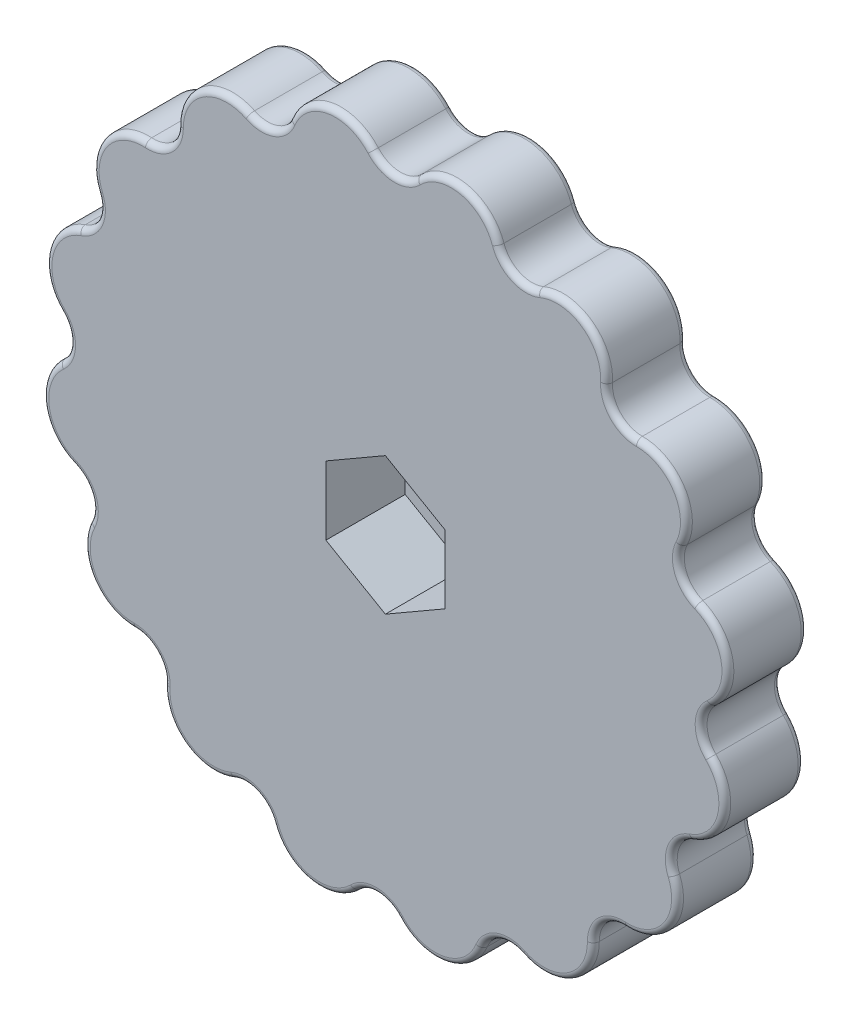
from build123d import *

# Parameters (mm, degrees)
BOSS_EXTRUDE1_DEPTH = 4
SKETCH2_R           = 6
BOSS_EXTRUDE2_DEPTH = 1.999999862
CUT_EXTRUDE1_REACH  = 27.171
SKETCH3_R           = 1.8
CUT_EXTRUDE2_DEPTH  = 4
FILLET1_R           = 0.5
FILLET2_R           = 0.3


with BuildPart() as part:
    # Sketch1 → Boss-Extrude1 (new body)
    with BuildSketch(Plane(origin=(0, 0, 1.999999862), x_dir=(-1, 0, 0), z_dir=(0, 0, -1))):
        with BuildLine():
            ThreePointArc((-1.539082875, 16.380637516), (-0.42924165, 15.932983314), (0.654887214, 16.439744045))
            ThreePointArc((0.654887214, 16.439744045), (2.950611225, 17.24946067), (4.846671421, 15.722717248))
            ThreePointArc((4.846671421, 15.722717248), (5.700721168, 14.884420844), (6.896254571, 14.937728556))
            ThreePointArc((6.896254571, 14.937728556), (9.327092134, 14.807273629), (10.49456393, 12.671155805))
            ThreePointArc((10.49456393, 12.671155805), (10.962800865, 11.569840227), (12.087729685, 11.161579305))
            ThreePointArc((12.087729685, 11.161579305), (14.283607817, 10.110813406), (14.544754213, 7.690525756))
            ThreePointArc((14.544754213, 7.690525756), (14.555893508, 6.493856317), (15.438957529, 5.686180785))
            ThreePointArc((15.438957529, 5.686180785), (17.065573691, 3.875073497), (16.380637516, 1.539082875))
            ThreePointArc((16.380637516, 1.539082875), (15.932983314, 0.42924165), (16.439744045, -0.654887214))
            ThreePointArc((16.439744045, -0.654887214), (17.24946067, -2.950611225), (15.722717248, -4.846671421))
            ThreePointArc((15.722717248, -4.846671421), (14.884420844, -5.700721168), (14.937728556, -6.896254571))
            ThreePointArc((14.937728556, -6.896254571), (14.807273629, -9.327092134), (12.671155805, -10.49456393))
            ThreePointArc((12.671155805, -10.49456393), (11.569840227, -10.962800865), (11.161579305, -12.087729685))
            ThreePointArc((11.161579305, -12.087729685), (10.110813406, -14.283607817), (7.690525756, -14.544754213))
            ThreePointArc((7.690525756, -14.544754213), (6.493856317, -14.555893508), (5.686180785, -15.438957529))
            ThreePointArc((5.686180785, -15.438957529), (3.875073497, -17.065573691), (1.539082875, -16.380637516))
            ThreePointArc((1.539082875, -16.380637516), (0.42924165, -15.932983314), (-0.654887214, -16.439744045))
            ThreePointArc((-0.654887214, -16.439744045), (-2.950611225, -17.24946067), (-4.846671421, -15.722717248))
            ThreePointArc((-4.846671421, -15.722717248), (-5.700721168, -14.884420844), (-6.896254571, -14.937728556))
            ThreePointArc((-6.896254571, -14.937728556), (-9.327092134, -14.807273629), (-10.49456393, -12.671155805))
            ThreePointArc((-10.49456393, -12.671155805), (-10.962800865, -11.569840227), (-12.087729685, -11.161579305))
            ThreePointArc((-12.087729685, -11.161579305), (-14.283607817, -10.110813406), (-14.544754213, -7.690525756))
            ThreePointArc((-14.544754213, -7.690525756), (-14.555893508, -6.493856317), (-15.438957529, -5.686180785))
            ThreePointArc((-15.438957529, -5.686180785), (-17.065573691, -3.875073497), (-16.380637516, -1.539082875))
            ThreePointArc((-16.380637516, -1.539082875), (-15.932983314, -0.42924165), (-16.439744045, 0.654887214))
            ThreePointArc((-16.439744045, 0.654887214), (-17.24946067, 2.950611225), (-15.722717248, 4.846671421))
            ThreePointArc((-15.722717248, 4.846671421), (-14.884420844, 5.700721168), (-14.937728556, 6.896254571))
            ThreePointArc((-14.937728556, 6.896254571), (-14.807273629, 9.327092134), (-12.671155805, 10.49456393))
            ThreePointArc((-12.671155805, 10.49456393), (-11.569840227, 10.962800865), (-11.161579305, 12.087729685))
            ThreePointArc((-11.161579305, 12.087729685), (-10.110813406, 14.283607817), (-7.690525756, 14.544754213))
            ThreePointArc((-7.690525756, 14.544754213), (-6.493856317, 14.555893508), (-5.686180785, 15.438957529))
            ThreePointArc((-5.686180785, 15.438957529), (-3.875073497, 17.065573691), (-1.539082875, 16.380637516))
        make_face()
    extrude(amount=-BOSS_EXTRUDE1_DEPTH)

    # Sketch2 → Boss-Extrude2 (add)
    with BuildSketch(Plane(origin=(0, 0, 1.999999862), x_dir=(-1, 0, 0), z_dir=(0, 0, -1))):
        with Locations(Location((0, 0, 0), (0, 0, 180))):
            Circle(SKETCH2_R)
    extrude(amount=BOSS_EXTRUDE2_DEPTH)

    # Sketch3 → Cut-Extrude1 (cut, up to next)
    with BuildSketch(Plane(origin=(0, 0, 5.999999862), x_dir=(-1, 0, 0), z_dir=(0, 0, -1)), mode=Mode.PRIVATE) as cut_extrude1_sk1:
        with Locations(Location((0, 0, 0), (0, 0, 180))):
            Circle(SKETCH3_R)
    cut_extrude1_tool1 = extrude(cut_extrude1_sk1.sketch, amount=CUT_EXTRUDE1_REACH, mode=Mode.PRIVATE) & part.part
    add(cut_extrude1_tool1.solids().sort_by_distance((0, 0, 6))[0], mode=Mode.SUBTRACT)

    # Sketch4 → Cut-Extrude2 (cut)
    with BuildSketch(Plane.XY.offset(5.999999862)):
        Polygon((0, 3.464101615), (-3, 1.732050808), (-3, -1.732050808), (0, -3.464101615), (3, -1.732050808), (3, 1.732050808), align=None)
    extrude(amount=-CUT_EXTRUDE2_DEPTH, mode=Mode.SUBTRACT)

    # Fillet1
    fillet1_edges = [part.edges().sort_by_distance(p)[0] for p in [
        (-6, 0, 1.999999862),
    ]]
    fillet(fillet1_edges, radius=FILLET1_R)

    # Fillet2
    fillet2_edges = [part.edges().sort_by_distance(p)[0] for p in [
        (3.875073497, 17.065573691, 5.999999862),
        (6.493856317, 14.555893508, 5.999999862),
        (10.110813406, 14.283607817, 5.999999862),
        (11.569840227, 10.962800865, 5.999999862),
        (14.807273629, 9.327092134, 5.999999862),
        (14.884420844, 5.700721168, 5.999999862),
        (-5.700721168, 14.884420844, 1.999999862),
        (-9.327092134, 14.807273629, 1.999999862),
        (-10.962800865, 11.569840227, 1.999999862),
        (17.24946067, 2.950611225, 5.999999862),
        (-14.283607817, 10.110813406, 1.999999862),
        (-14.555893508, 6.493856317, 1.999999862),
        (-17.065573691, 3.875073497, 1.999999862),
        (-15.932983314, 0.42924165, 1.999999862),
        (-17.24946067, -2.950611225, 1.999999862),
        (-14.884420844, -5.700721168, 1.999999862),
        (-14.807273629, -9.327092134, 1.999999862),
        (-11.569840227, -10.962800865, 1.999999862),
        (15.932983314, -0.42924165, 5.999999862),
        (-10.110813406, -14.283607817, 1.999999862),
        (-6.493856317, -14.555893508, 1.999999862),
        (-3.875073497, -17.065573691, 1.999999862),
        (-0.42924165, -15.932983314, 1.999999862),
        (2.950611225, -17.24946067, 1.999999862),
        (5.700721168, -14.884420844, 1.999999862),
        (9.327092134, -14.807273629, 1.999999862),
        (17.065573691, -3.875073497, 5.999999862),
        (10.962800865, -11.569840227, 1.999999862),
        (14.283607817, -10.110813406, 1.999999862),
        (14.555893508, -6.493856317, 1.999999862),
        (17.065573691, -3.875073497, 1.999999862),
        (15.932983314, -0.42924165, 1.999999862),
        (17.24946067, 2.950611225, 1.999999862),
        (14.884420844, 5.700721168, 1.999999862),
        (14.807273629, 9.327092134, 1.999999862),
        (14.555893508, -6.493856317, 5.999999862),
        (11.569840227, 10.962800865, 1.999999862),
        (10.110813406, 14.283607817, 1.999999862),
        (6.493856317, 14.555893508, 1.999999862),
        (3.875073497, 17.065573691, 1.999999862),
        (0.42924165, 15.932983314, 1.999999862),
        (-2.950611225, 17.24946067, 1.999999862),
        (-2.950611225, 17.24946067, 5.999999862),
        (14.283607817, -10.110813406, 5.999999862),
        (10.962800865, -11.569840227, 5.999999862),
        (9.327092134, -14.807273629, 5.999999862),
        (5.700721168, -14.884420844, 5.999999862),
        (2.950611225, -17.24946067, 5.999999862),
        (-0.42924165, -15.932983314, 5.999999862),
        (-3.875073497, -17.065573691, 5.999999862),
        (-6.493856317, -14.555893508, 5.999999862),
        (-10.110813406, -14.283607817, 5.999999862),
        (-11.569840227, -10.962800865, 5.999999862),
        (0.42924165, 15.932983314, 5.999999862),
        (-14.807273629, -9.327092134, 5.999999862),
        (-14.884420844, -5.700721168, 5.999999862),
        (-17.24946067, -2.950611225, 5.999999862),
        (-15.932983314, 0.42924165, 5.999999862),
        (-17.065573691, 3.875073497, 5.999999862),
        (-14.555893508, 6.493856317, 5.999999862),
        (-14.283607817, 10.110813406, 5.999999862),
        (-10.962800865, 11.569840227, 5.999999862),
        (-9.327092134, 14.807273629, 5.999999862),
        (-5.700721168, 14.884420844, 5.999999862),
    ]]
    fillet(fillet2_edges, radius=FILLET2_R)


solid = part.part
